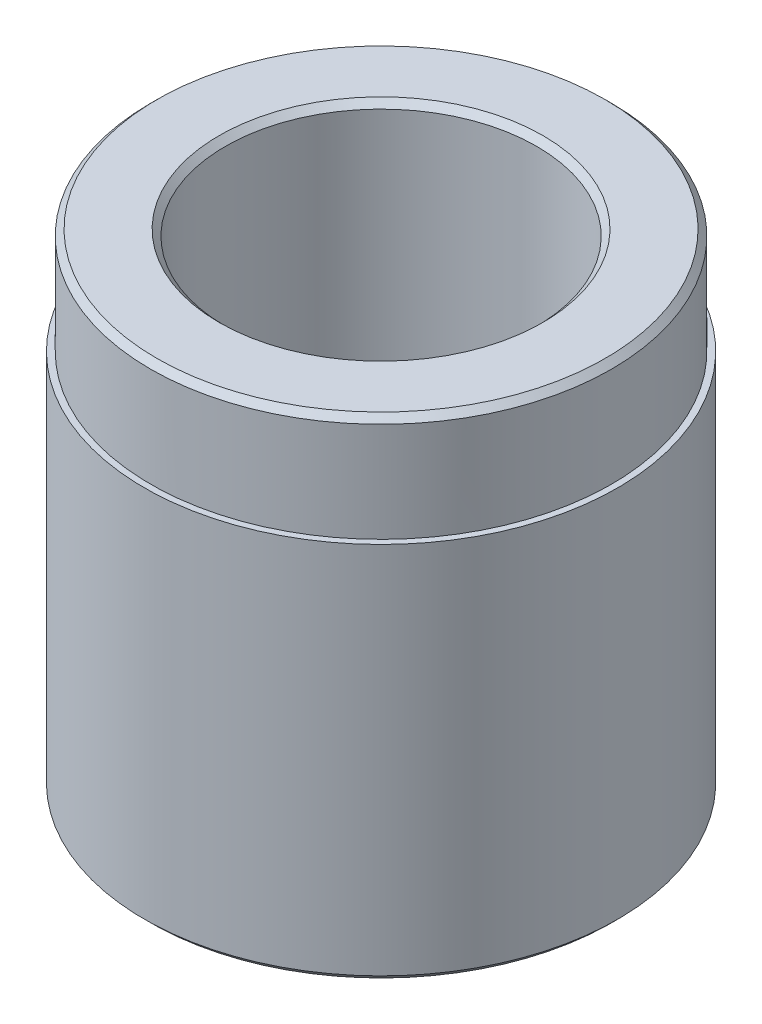
from build123d import *

# Parameters (mm, degrees)
CHAMFER_1_SIZE = 1


with BuildPart() as part:
    # 草图1 → 旋转1 (revolve)
    with BuildSketch(Plane.XY, mode=Mode.PRIVATE) as revolve_1_sk:
        Polygon((25, 0), (25, 78), (37, 78), (37, 61), (38, 61), (38, 0), align=None)
    revolve(revolve_1_sk.sketch.rotate(Axis((0, 0, 0), (0, 1, 0)), 90), axis=Axis((0, 0, 0), (0, 1, 0)))

    # 倒角1
    chamfer_1_edges = [part.edges().sort_by_distance(p)[0] for p in [
        (0, 78, 37),
        (0, 78, 25),
        (0, 0, 25),
        (0, 0, 38),
    ]]
    chamfer(chamfer_1_edges, length=CHAMFER_1_SIZE)


solid = part.part
